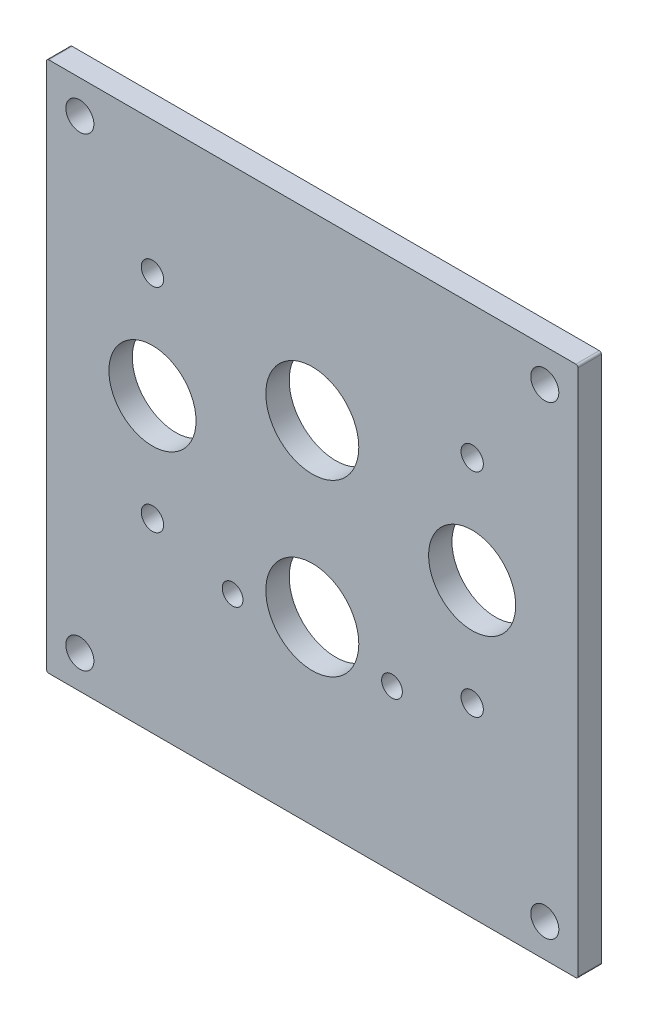
from build123d import *
from build123d.topology import SkipClean

# Parameters (mm, degrees)
SKETCH1_W      = 63.5
SKETCH1_H      = 127
EXTRUDE1_DEPTH = 2.795
SKETCH2_R      = 3.3528
SKETCH2_R_2    = 10.414
SKETCH2_R_3    = 2.667
SKETCH2_R_4    = 2.4765
SKETCH2_R_5    = 11.1125
EXTRUDE2_DEPTH = 90.976375233
FILLET1_R      = 0.508


with BuildPart() as part:
    # Sketch1 → Extrude1 (new, symmetric)
    with BuildSketch(Plane.XY):
        with Locations((-31.75, 0)):
            Rectangle(SKETCH1_W, SKETCH1_H)
    extrude(amount=EXTRUDE1_DEPTH, both=True)

    # Sketch2 → Extrude2 (cut, through all)
    with BuildSketch(Plane.XY.offset(2.795)):
        with Locations((-55.5625, 55.5625)):
            Circle(SKETCH2_R)
        with Locations((-38.2016, 6.35)):
            Circle(SKETCH2_R_2)
        with Locations((-38.2082548, -19.05)):
            Circle(SKETCH2_R_3)
        with Locations((-19.05, -25.1079)):
            Circle(SKETCH2_R_4)
        with Locations((-38.2082548, 31.75)):
            Circle(SKETCH2_R_3)
        with Locations((0, -20.3454)):
            Circle(SKETCH2_R_5)
        with Locations((-55.5625, -55.5625)):
            Circle(SKETCH2_R)
        with Locations((0, 20.3454)):
            Circle(SKETCH2_R_5)
    extrude(amount=-EXTRUDE2_DEPTH, mode=Mode.SUBTRACT)

    # Fillet1
    fillet1_edges = [part.edges().sort_by_distance(p)[0] for p in [
        (-63.5, -63.5, 0),
        (-63.5, 63.5, 0),
    ]]
    fillet(fillet1_edges, radius=FILLET1_R)

    # Mirror1: part across plane


with BuildPart() as part_1:
    with SkipClean():  # the faces are left unmerged after this step: merging them gives an invalid solid
        add(part.part)
        add(part.part.mirror(Plane(origin=(0, -110.583968638, 2.795), x_dir=(0, 0, 1), z_dir=(1, 0, 0))))


solid = part_1.part
